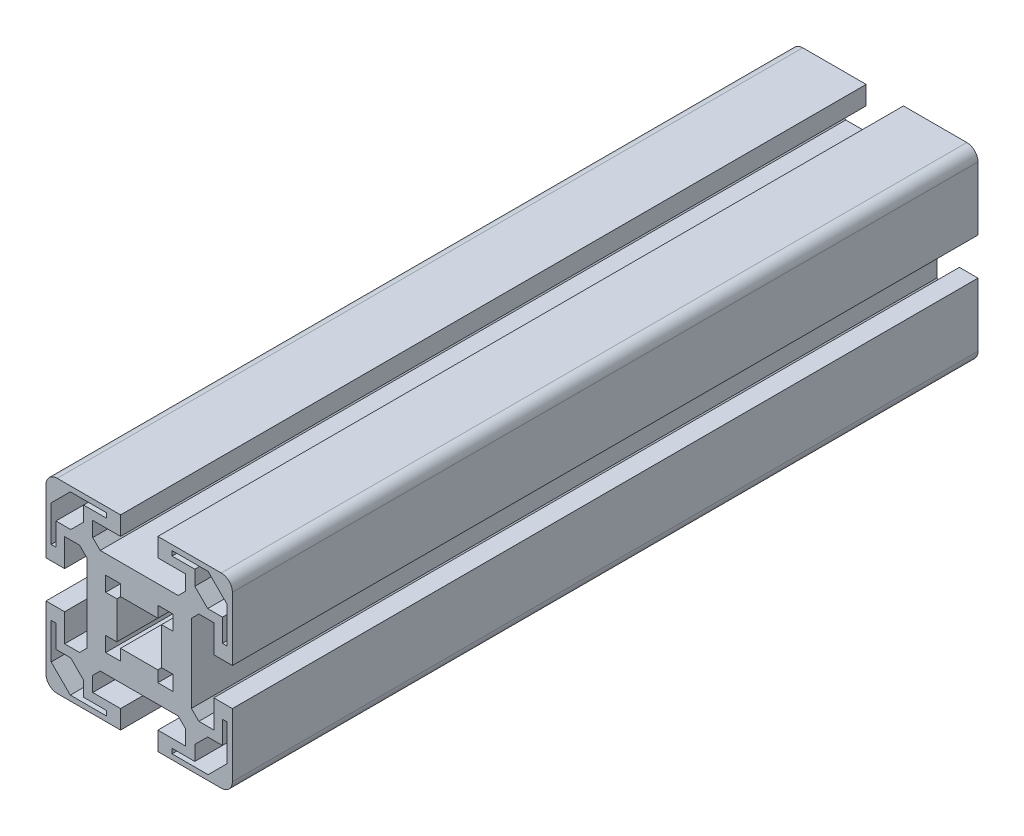
from build123d import *

# Parameters (mm, degrees)
SALIENTE_EXTRUIR1_DEPTH = 100


with BuildPart() as part:
    # Croquis1 → Saliente-Extruir1 (new, symmetric)
    with BuildSketch(Plane.XY):
        with BuildLine():
            Line((5, 25), (22, 25))
            ThreePointArc((22, 25), (24.121320344, 24.121320344), (25, 22))
            Line((25, 22), (25, 5))
            Line((25, 5), (20, 5))
            Line((20, 5), (20, 12.464466094))
            Line((20, 12.464466094), (16, 12.464466094))
            Line((16, 12.464466094), (14, 10.464466094))
            Line((14, 10.464466094), (14, 0))
            Line((14, 0), (6, 0))
            Line((6, 0), (6, 5))
            Line((6, 5), (9, 5))
            Line((9, 5), (9, 9))
            Line((9, 9), (5, 9))
            Line((5, 9), (5, 6))
            Line((5, 6), (0, 6))
            Line((0, 6), (0, 14))
            Line((0, 14), (10.464466094, 14))
            Line((10.464466094, 14), (12.464466094, 16))
            Line((12.464466094, 16), (12.464466094, 20))
            Line((12.464466094, 20), (5, 20))
            Line((5, 20), (5, 25))
        make_face()
        Polygon((23.61230751, 18.478547627), (18.478547627, 23.61230751), (8.817158017, 23.61230751), (8.817158017, 22.328867539), (14.913358785, 22.328867539), (14.913358785, 18.359777384), (18.359777384, 14.913358785), (22.328867539, 14.913358785), (22.328867539, 8.817158017), (23.61230751, 8.817158017), align=None, mode=Mode.SUBTRACT)
    saliente_extruir1 = extrude(amount=SALIENTE_EXTRUIR1_DEPTH, both=True)

    # Simetría1: Saliente-Extruir1 across plane
    add(saliente_extruir1.mirror(Plane(origin=(0, 14, 100), x_dir=(0, 0, 1), z_dir=(1, 0, 0))))

    # Simetría7: part across plane


with BuildPart() as part_1:
    add(part.part)
    add(part.part.mirror(Plane(origin=(6, 0, 100), x_dir=(0, 0, 1), z_dir=(0, 1, 0))))


solid = part_1.part
